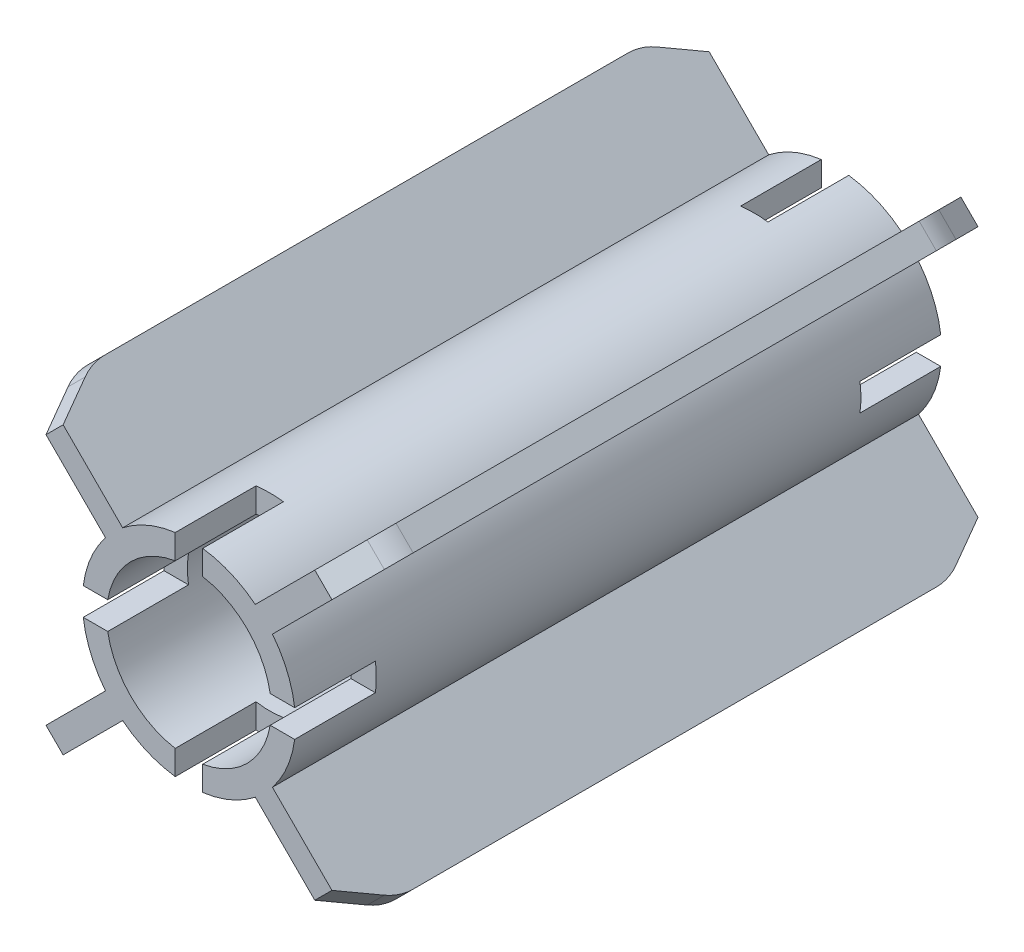
from build123d import *

# Parameters (mm, degrees)
SKETCH1_R                = 13.2
SKETCH1_R_2              = 10.2
BOSS_EXTRUDE1_DEPTH      = 80
SKETCH2_W                = 3.4
SKETCH2_H                = 3.142664369
CUT_EXTRUDE1_DEPTH       = 10
CIRPATTERN1_COUNT        = 4
MIRROR1_COPY_1_SKETCH_W  = 3.4
MIRROR1_COPY_1_SKETCH_H  = 3.142664369
MIRROR1_COPY_1_DEPTH     = 10
MIRROR1_COPY_2_SKETCH_W  = 3.4
MIRROR1_COPY_2_SKETCH_H  = 3.142664369
MIRROR1_COPY_2_DEPTH     = 10
MIRROR1_COPY_3_SKETCH_W  = 3.4
MIRROR1_COPY_3_SKETCH_H  = 3.142664369
MIRROR1_COPY_3_DEPTH     = 10
BOSS_EXTRUDE3_DEPTH      = 1.5
FILLET1_R                = 6
CIRPATTERN2_COUNT        = 4
FILLET1_OF_CIRPATTERN2_R = 6


with BuildPart() as part:
    # Sketch1 → Boss-Extrude1 (new body)
    with BuildSketch(Plane.XY):
        Circle(SKETCH1_R)
        Circle(SKETCH1_R_2, mode=Mode.SUBTRACT)
    extrude(amount=BOSS_EXTRUDE1_DEPTH)

    # Sketch2 → Cut-Extrude1 (cut)
    with BuildSketch(Plane.XY.offset(80)):
        with Locations((0, 11.628667816)):
            Rectangle(SKETCH2_W, SKETCH2_H)
    cut_extrude1 = extrude(amount=-CUT_EXTRUDE1_DEPTH, mode=Mode.SUBTRACT)

    # CirPattern1: Cut-Extrude1 ×4 about axis
    cirpattern1_axis = Axis((0, 0, 0), (0, 0, 1))
    for i in range(1, CIRPATTERN1_COUNT):
        add(cut_extrude1.rotate(cirpattern1_axis, i * 360 / CIRPATTERN1_COUNT), mode=Mode.SUBTRACT)

    # Mirror1: Cut-Extrude1 across plane
    add(cut_extrude1.mirror(Plane.XY.offset(40)), mode=Mode.SUBTRACT)

    # Mirror1 copy 1 sketch → Mirror1 copy 1 (cut)
    with BuildSketch(Plane.YX):
        with Locations((0, -11.628667816)):
            Rectangle(MIRROR1_COPY_1_SKETCH_W, MIRROR1_COPY_1_SKETCH_H)
    extrude(amount=-MIRROR1_COPY_1_DEPTH, mode=Mode.SUBTRACT)

    # Mirror1 copy 2 sketch → Mirror1 copy 2 (cut)
    with BuildSketch(Plane(origin=(0, 0, 0), x_dir=(-1, 0, 0), z_dir=(0, 0, -1))):
        with Locations((0, -11.628667816)):
            Rectangle(MIRROR1_COPY_2_SKETCH_W, MIRROR1_COPY_2_SKETCH_H)
    extrude(amount=-MIRROR1_COPY_2_DEPTH, mode=Mode.SUBTRACT)

    # Mirror1 copy 3 sketch → Mirror1 copy 3 (cut)
    with BuildSketch(Plane(origin=(0, 0, 0), x_dir=(0, -1, 0), z_dir=(0, 0, -1))):
        with Locations((0, -11.628667816)):
            Rectangle(MIRROR1_COPY_3_SKETCH_W, MIRROR1_COPY_3_SKETCH_H)
    extrude(amount=-MIRROR1_COPY_3_DEPTH, mode=Mode.SUBTRACT)

    # Sketch5 → Boss-Extrude3 (add, symmetric)
    with BuildSketch(Plane(origin=(0, 0, 0), x_dir=(-0.70710678118655, -0.7071067811865451, 0), z_dir=(0.7071067811865451, -0.70710678118655, 0))):
        Polygon((11.2, 0), (13.2, 0), (23.535898385, 0), (27, -6), (27, -74), (23.535898385, -80), (13.2, -80), (11.2, -80), align=None)
    boss_extrude3 = extrude(amount=BOSS_EXTRUDE3_DEPTH, both=True)

    # Fillet1
    fillet1_edges = [part.edges().sort_by_distance(p)[0] for p in [
        (-19.091883092, -19.091883092, 74),
        (-19.091883092, -19.091883092, 6),
    ]]
    fillet(fillet1_edges, radius=FILLET1_R)

    # CirPattern2: Boss-Extrude3 ×4 about axis
    cirpattern2_axis = Axis((0, 0, 0), (0, 0, 1))
    for i in range(1, CIRPATTERN2_COUNT):
        add(boss_extrude3.rotate(cirpattern2_axis, i * 360 / CIRPATTERN2_COUNT))

    # Fillet1 of CirPattern2
    fillet1_of_cirpattern2_edges = [part.edges().sort_by_distance(p)[0] for p in [
        (19.091883092, -19.091883092, 74),
        (19.091883092, -19.091883092, 6),
        (19.091883092, 19.091883092, 74),
        (19.091883092, 19.091883092, 6),
        (-19.091883092, 19.091883092, 74),
        (-19.091883092, 19.091883092, 6),
    ]]
    fillet(fillet1_of_cirpattern2_edges, radius=FILLET1_OF_CIRPATTERN2_R)


solid = part.part
